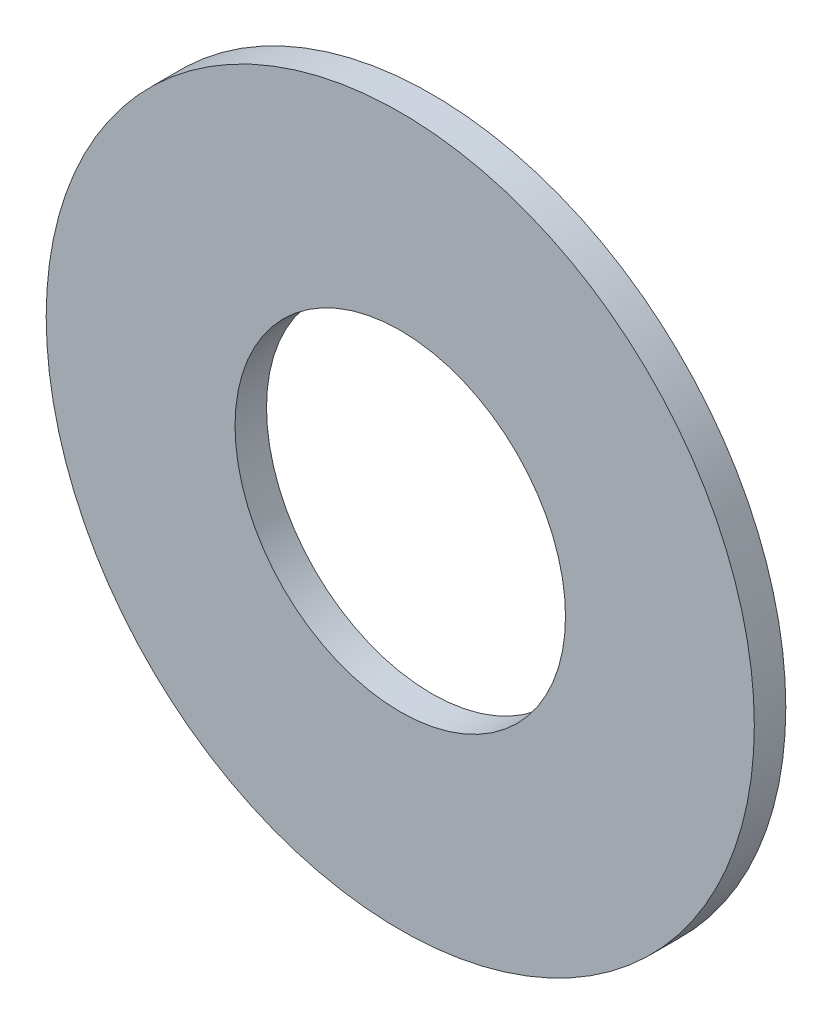
from build123d import *

# Parameters (mm, degrees)
SKETCH_1_R      = 22.5
SKETCH_1_R_2    = 10.5
EXTRUDE_1_DEPTH = 2


with BuildPart() as part:
    # 草图1 → 拉伸1 (new body)
    with BuildSketch(Plane.XY):
        Circle(SKETCH_1_R)
        Circle(SKETCH_1_R_2, mode=Mode.SUBTRACT)
    extrude(amount=EXTRUDE_1_DEPTH)


solid = part.part
